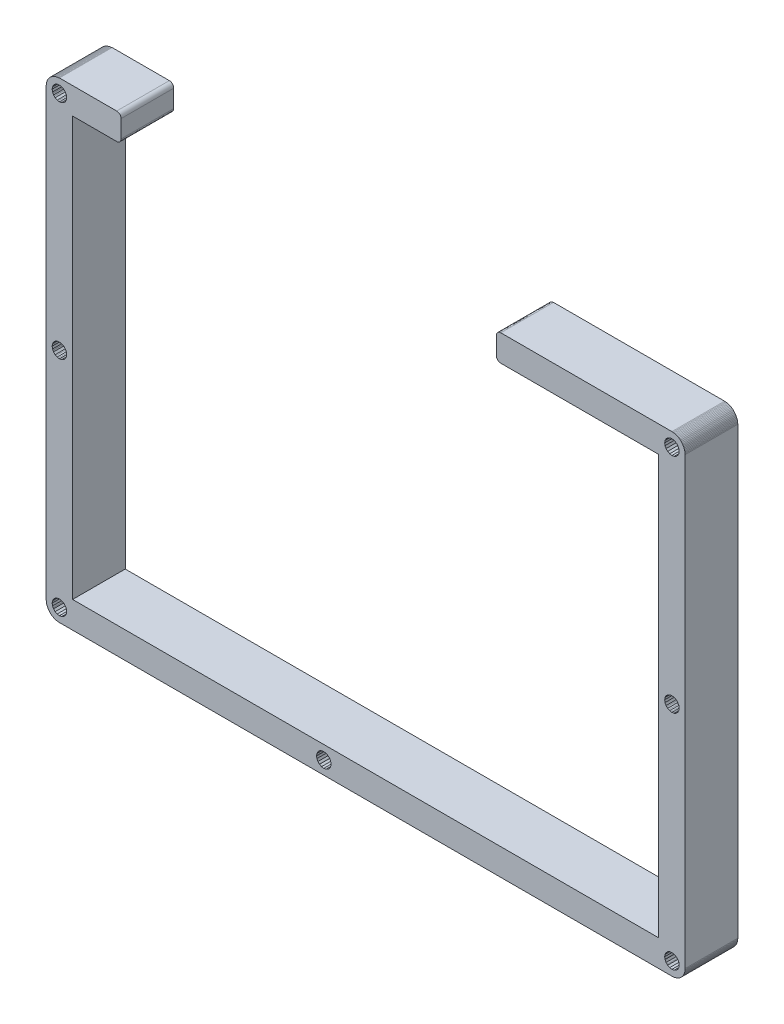
from build123d import *

# Parameters (mm, degrees)
BOSS_EXTRUDE1_DEPTH = 12


with BuildPart() as part:
    # Model → Boss-Extrude1 (new body)
    with BuildSketch(Plane.XY):
        with BuildLine():
            Line((150.556824471, 109.401895464), (150.546933191, 109.638226396))
            Line((150.546933191, 109.638226396), (150.520085432, 109.872437768))
            Line((150.520085432, 109.872437768), (150.473808374, 110.103823061))
            Line((150.473808374, 110.103823061), (150.409867886, 110.330970761))
            Line((150.409867886, 110.330970761), (150.327558309, 110.552464774))
            Line((150.327558309, 110.552464774), (150.229352032, 110.765833807))
            Line((150.229352032, 110.765833807), (150.112958588, 110.973070913))
            Line((150.112958588, 110.973070913), (149.985387149, 111.164946656))
            Line((149.985387149, 111.164946656), (149.839137513, 111.35040815))
            Line((149.839137513, 111.35040815), (149.679110738, 111.523505545))
            Line((149.679110738, 111.523505545), (149.502033375, 111.737511263))
            Line((149.502033375, 111.737511263), (149.316925141, 111.883760898))
            Line((149.316925141, 111.883760898), (149.120509941, 112.01411559))
            Line((149.120509941, 112.01411559), (148.914206107, 112.130338126))
            Line((148.914206107, 112.130338126), (148.701190334, 112.228191143))
            Line((148.701190334, 112.228191143), (148.479696321, 112.310500721))
            Line((148.479696321, 112.310500721), (148.252548647, 112.374441301))
            Line((148.252548647, 112.374441301), (148.021163355, 112.420718359))
            Line((148.021163355, 112.420718359), (147.786951982, 112.447566118))
            Line((147.786951982, 112.447566118), (147.55132757, 112.456750878))
            Line((147.55132757, 112.456750878), (108.572621129, 112.456750878))
            add(Edge.make_bspline(
                [(108.572621129, 112.456750878), (108.018356206, 112.456750878), (107.569009501, 112.007404172), (107.569009501, 111.45278599)],
                knots=[0, 0, 0, 0, 1, 1, 1, 1], degree=3))
            Line((107.569009501, 111.45278599), (107.569009501, 107.449997059))
            add(Edge.make_bspline(
                [(107.569009501, 107.449997059), (107.569009501, 106.896791917), (108.017296426, 106.448504991), (108.570501569, 106.448504991)],
                knots=[0, 0, 0, 0, 1, 1, 1, 1], degree=3))
            Line((108.570501569, 106.448504991), (144.547557886, 106.448504991))
            Line((144.547557886, 106.448504991), (144.547557886, 11.068310528))
            Line((144.547557886, 11.068310528), (11.014225576, 11.068310528))
            Line((11.014225576, 11.068310528), (11.014225576, 106.448504991))
            Line((11.014225576, 106.448504991), (21.060586393, 106.448504991))
            add(Edge.make_bspline(
                [(21.060586393, 106.448504991), (21.611671622, 106.448504991), (22.058545508, 106.895378877), (22.058545508, 107.446464459)],
                knots=[0, 0, 0, 0, 1, 1, 1, 1], degree=3))
            Line((22.058545508, 107.446464459), (22.058545508, 111.45985119))
            add(Edge.make_bspline(
                [(22.058545508, 111.45985119), (22.058545508, 112.010936772), (21.612024882, 112.457810658), (21.060586393, 112.457810658)],
                knots=[0, 0, 0, 0, 1, 1, 1, 1], degree=3))
            Line((21.060586393, 112.457810658), (8.010102632, 112.457810658))
            Line((8.010102632, 112.457810658), (7.77458747, 112.395342943))
            Line((7.77458747, 112.395342943), (7.540023118, 112.368492732))
            Line((7.540023118, 112.368492732), (7.308991569, 112.322213258))
            Line((7.308991569, 112.322213258), (7.081492805, 112.258270822))
            Line((7.081492805, 112.258270822), (6.860353266, 112.175958934))
            Line((6.860353266, 112.175958934), (6.646985256, 112.078103686))
            Line((6.646985256, 112.078103686), (6.440682637, 111.961878994))
            Line((6.440682637, 111.961878994), (6.244268799, 111.831522248))
            Line((6.244268799, 111.831522248), (6.059162094, 111.685270678))
            Line((6.059162094, 111.685270678), (5.886066372, 111.525242094))
            Line((5.886066372, 111.525242094), (5.725688147, 111.352143023))
            Line((5.725688147, 111.352143023), (5.57944045, 111.166680001))
            Line((5.57944045, 111.166680001), (5.449442824, 110.970619348))
            Line((5.449442824, 110.970619348), (5.333222444, 110.7643143))
            Line((5.333222444, 110.7643143), (5.235018397, 110.55094424))
            Line((5.235018397, 110.55094424), (5.153064395, 110.329449371))
            Line((5.153064395, 110.329449371), (5.088773451, 110.102302526))
            Line((5.088773451, 110.102302526), (5.042852072, 109.870916753))
            Line((5.042852072, 109.870916753), (5.015653501, 109.636705097))
            Line((5.015653501, 109.636705097), (5.006824471, 109.400374072))
            Line((5.006824471, 109.400374072), (5.006824471, 8.011933717))
            Line((5.006824471, 8.011933717), (5.016715751, 7.775602784))
            Line((5.016715751, 7.775602784), (5.04391677, 7.541391412))
            Line((5.04391677, 7.541391412), (5.089840568, 7.310006119))
            Line((5.089840568, 7.310006119), (5.154133886, 7.082506686))
            Line((5.154133886, 7.082506686), (5.236090204, 6.861365933))
            Line((5.236090204, 6.861365933), (5.334296481, 6.6479969))
            Line((5.334296481, 6.6479969), (5.450519017, 6.441693067))
            Line((5.450519017, 6.441693067), (5.580518693, 6.245633773))
            Line((5.580518693, 6.245633773), (5.726768328, 6.060172279))
            Line((5.726768328, 6.060172279), (5.887148363, 5.887074885))
            Line((5.887148363, 5.887074885), (6.060245757, 5.72669485))
            Line((6.060245757, 5.72669485), (6.245353991, 5.580445215))
            Line((6.245353991, 5.580445215), (6.441766545, 5.450445539))
            Line((6.441766545, 5.450445539), (6.648070378, 5.334223003))
            Line((6.648070378, 5.334223003), (6.861439412, 5.236016726))
            Line((6.861439412, 5.236016726), (7.082580122, 5.154060293))
            Line((7.082580122, 5.154060293), (7.310079554, 5.090120235))
            Line((7.310079554, 5.090120235), (7.541111587, 5.043843177))
            Line((7.541111587, 5.043843177), (7.77567622, 5.016995418))
            Line((7.77567622, 5.016995418), (8.012007152, 5.007810658))
            Line((8.012007152, 5.007810658), (147.552525573, 5.007810658))
            Line((147.552525573, 5.007810658), (147.795955681, 5.018364787))
            Line((147.795955681, 5.018364787), (148.03016685, 5.045214325))
            Line((148.03016685, 5.045214325), (148.261551791, 5.091493141))
            Line((148.261551791, 5.091493141), (148.488698979, 5.155435446))
            Line((148.488698979, 5.155435446), (148.71019237, 5.237393445))
            Line((148.71019237, 5.237393445), (148.923207397, 5.33560134))
            Line((148.923207397, 5.33560134), (149.129510348, 5.451825443))
            Line((149.129510348, 5.451825443), (149.325921914, 5.581826611))
            Line((149.325921914, 5.581826611), (149.511029037, 5.728077652))
            Line((149.511029037, 5.728077652), (149.684478474, 5.888459004))
            Line((149.684478474, 5.888459004), (149.844503934, 6.061557614))
            Line((149.844503934, 6.061557614), (149.990752161, 6.247020219))
            Line((149.990752161, 6.247020219), (150.114013083, 6.441693067))
            Line((150.114013083, 6.441693067), (150.229352577, 6.649518602))
            Line((150.229352577, 6.649518602), (150.327558854, 6.862887635))
            Line((150.327558854, 6.862887635), (150.409868316, 7.084028078))
            Line((150.409868316, 7.084028078), (150.473808374, 7.311527511))
            Line((150.473808374, 7.311527511), (150.520085432, 7.542912803))
            Line((150.520085432, 7.542912803), (150.546933191, 7.777124176))
            Line((150.546933191, 7.777124176), (150.556824471, 8.013455108))
            Line((150.556824471, 8.013455108), (150.556824471, 109.401895464))
        make_face()
        Polygon((9.66420143, 8.011933604), (9.582953719, 7.501119329), (9.34768271, 7.040468584), (8.982411882, 6.675197755), (8.521761137, 6.439926746), (8.010947193, 6.358676949), (7.501192898, 6.439926767), (7.040542226, 6.675197919), (6.675271398, 7.040468748), (6.439646985, 7.501119773), (6.358750448, 8.011933717), (6.439646985, 8.52168788), (6.675271398, 8.982338905), (7.040542226, 9.347609734), (7.501193178, 9.583234289), (8.012007121, 9.664130827), (8.521761285, 9.583234289), (8.98241231, 9.347609877), (9.347683138, 8.982339049), (9.582954148, 8.521688304), align=None, mode=Mode.SUBTRACT)
        Polygon((69.896443659, 8.011933585), (69.815193862, 7.501119641), (69.580982632, 7.040468897), (69.215358332, 6.675197857), (68.754707587, 6.439926848), (68.244246322, 6.358677182), (67.733432379, 6.439926979), (67.272781633, 6.675197989), (66.907157333, 7.040469028), (66.672946104, 7.501119773), (66.592049566, 8.011933717), (66.672946104, 8.52168788), (66.907157333, 8.982338625), (67.272781633, 9.347609665), (67.733432659, 9.583234077), (68.244246602, 9.664130614), (68.754707286, 9.583234077), (69.215358311, 9.347609665), (69.580982611, 8.982338625), (69.815193841, 8.52168788), align=None, mode=Mode.SUBTRACT)
        Polygon((9.664203385, 58.706153292), (9.582953587, 58.195339348), (9.347682578, 57.734688603), (8.98241175, 57.369417775), (8.521761005, 57.134853285), (8.010947061, 57.053956748), (7.501192898, 57.134853285), (7.040542226, 57.369417918), (6.675271398, 57.734688746), (6.439646985, 58.195339771), (6.358750448, 58.706153715), (6.439646985, 59.216967658), (6.675271398, 59.677618684), (7.040542226, 60.042889512), (7.501192898, 60.277100884), (8.012006841, 60.358350682), (8.521761005, 60.277100038), (8.98241175, 60.042888809), (9.347682578, 59.67761798), (9.582953587, 59.216967235), align=None, mode=Mode.SUBTRACT)
        Polygon((149.205782693, 8.011933134), (149.124532895, 7.501119191), (148.889261886, 7.040468446), (148.523637586, 6.675197406), (148.062986914, 6.439926253), (147.553232619, 6.358676435), (147.042771388, 6.439926319), (146.582120643, 6.675197329), (146.216496343, 7.040468369), (145.981222792, 7.501117815), (145.901035304, 8.011932715), (145.981225431, 8.521687573), (146.21649644, 8.982338318), (146.58212074, 9.347609358), (147.042771766, 9.58323377), (147.553232449, 9.664130308), (148.062986613, 9.58323377), (148.523637565, 9.347609215), (148.889261865, 8.982338175), (149.124532874, 8.52168743), align=None, mode=Mode.SUBTRACT)
        Polygon((149.205781595, 58.706153313), (149.124531798, 58.195339369), (148.889260788, 57.734688624), (148.523636488, 57.369417584), (148.062985816, 57.134852952), (147.553231653, 57.053956414), (147.042770969, 57.134852952), (146.582120224, 57.369417441), (146.216495924, 57.734688481), (145.981224915, 58.195339226), (145.901034812, 58.706153715), (145.981221476, 59.216968743), (146.216495246, 59.677618078), (146.582119546, 60.042889118), (147.042770291, 60.277100348), (147.553231521, 60.358350232), (148.062985816, 60.277100414), (148.523636488, 60.042889041), (148.889260788, 59.677618001), (149.124531798, 59.216967256), align=None, mode=Mode.SUBTRACT)
        Polygon((9.664202736, 109.400374875), (9.582952918, 108.89062058), (9.347681909, 108.429969835), (8.982410869, 108.064345535), (8.521760124, 107.829074526), (8.01094618, 107.748177988), (7.501192016, 107.829074526), (7.040541344, 108.064345678), (6.675270305, 108.429969978), (6.439645892, 108.890621003), (6.358749355, 109.401434947), (6.439645892, 109.911189111), (6.675267598, 110.371484222), (7.040538637, 110.737108522), (7.501189309, 110.972379675), (8.012003798, 111.052569778), (8.521758656, 110.972379651), (8.982409401, 110.737108641), (9.347682091, 110.371485989), (9.582952939, 109.911188819), align=None, mode=Mode.SUBTRACT)
        Polygon((149.205782186, 109.400374487), (149.124532368, 108.890620192), (148.889261358, 108.429969447), (148.523637307, 108.064345395), (148.062986635, 107.829074243), (147.553232471, 107.748177705), (147.042771788, 107.829074243), (146.582121042, 108.064345252), (146.216496991, 108.429969304), (145.981224502, 108.890619293), (145.901034812, 109.401433846), (145.981224939, 109.911188705), (146.216495982, 110.371485775), (146.582120033, 110.737109827), (147.042770778, 110.972380836), (147.553231958, 111.052570932), (148.062986817, 110.972380805), (148.523637489, 110.737109652), (148.88926154, 110.371485601), (149.124532389, 109.911188431), align=None, mode=Mode.SUBTRACT)
    extrude(amount=BOSS_EXTRUDE1_DEPTH)


solid = part.part
